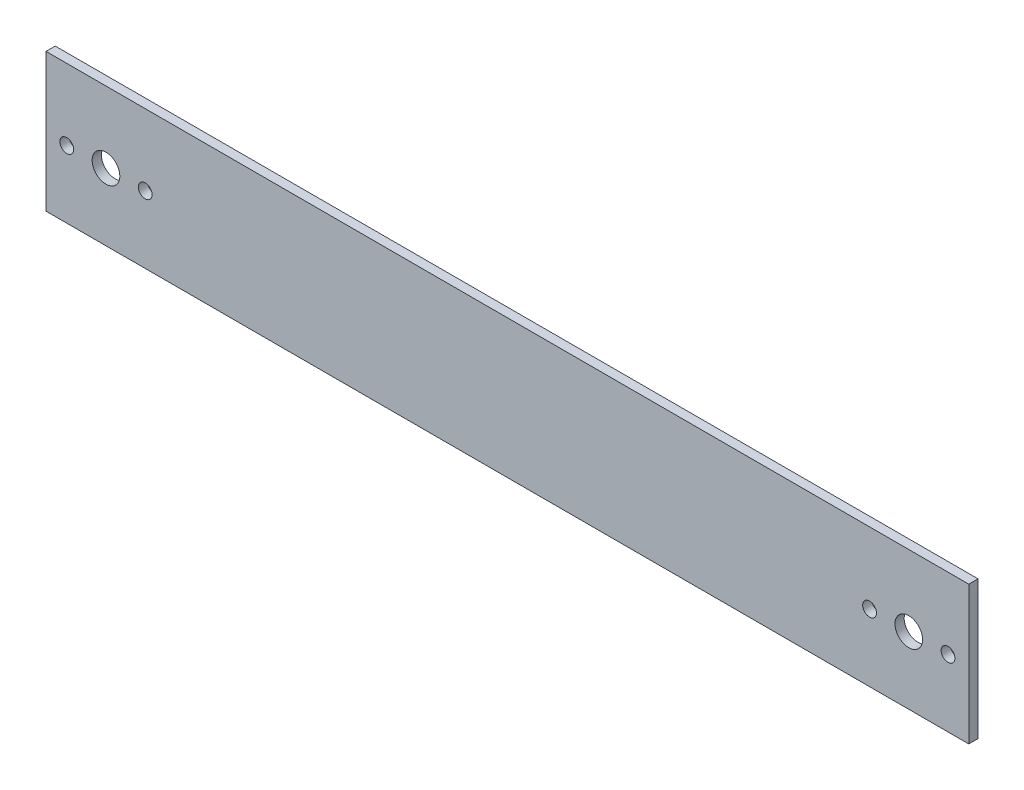
from build123d import *

# Parameters (mm, degrees)
SKETCH1_W           = 100
SKETCH1_H           = 30
BOSS_EXTRUDE1_DEPTH = 2
SKETCH2_R           = 3
SKETCH2_R_2         = 1.5
CUT_EXTRUDE2_DEPTH  = 2


with BuildPart() as part:
    # Sketch1 → Boss-Extrude1 (new body)
    with BuildSketch(Plane.XY):
        with Locations((-27.462887989, 20.627530364)):
            Rectangle(SKETCH1_W, SKETCH1_H)
    boss_extrude1 = extrude(amount=BOSS_EXTRUDE1_DEPTH)

    # Sketch2 → Cut-Extrude2 (cut)
    with BuildSketch(Plane.XY.offset(2)):
        with Locations((-64.462887989, 20.196984479)):
            Circle(SKETCH2_R)
        with Locations((-72.962887989, 20.196984479)):
            Circle(SKETCH2_R_2)
        with Locations((-55.962887989, 20.196984479)):
            Circle(SKETCH2_R_2)
    cut_extrude2 = extrude(amount=-CUT_EXTRUDE2_DEPTH, mode=Mode.SUBTRACT)

    # Mirror2: Boss-Extrude1, Cut-Extrude2 across plane
    add(boss_extrude1.mirror(Plane(origin=(22.537112011, 35.627530364, 2), x_dir=(0, 0, 1), z_dir=(-1, 0, 0))))
    add(cut_extrude2.mirror(Plane(origin=(22.537112011, 35.627530364, 2), x_dir=(0, 0, 1), z_dir=(-1, 0, 0))), mode=Mode.SUBTRACT)


solid = part.part
